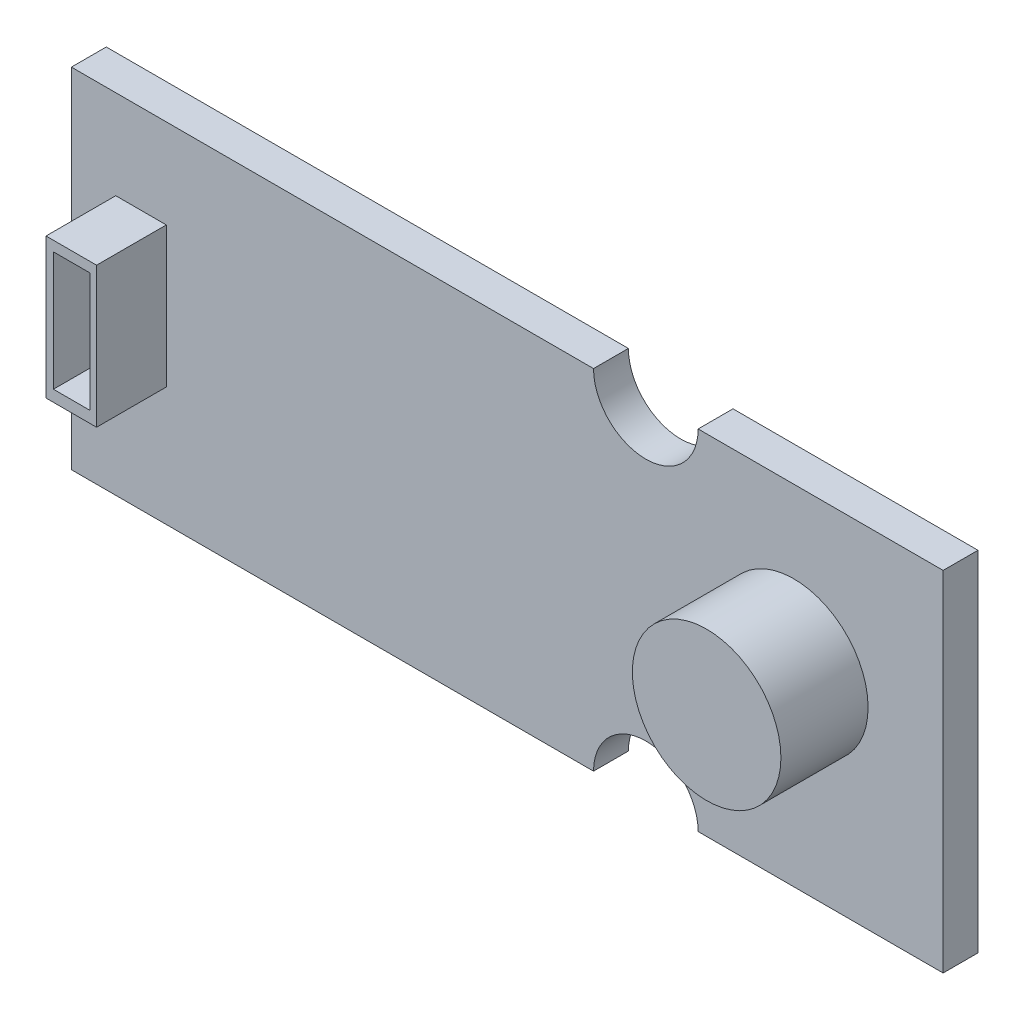
from build123d import *

# Parameters (mm, degrees)
ESQUISSE1_W             = 50
ESQUISSE1_H             = 20
BOSS_EXTRU_1_DEPTH      = 2
ESQUISSE2_R             = 4.260694663
BOSS_EXTRU_2_DEPTH      = 5
ESQUISSE3_R             = 3
ENL_V_MAT_EXTRU_1_DEPTH = 8
ESQUISSE4_W             = 2.90032215
ESQUISSE4_H             = 8.050990352
BOSS_EXTRU_3_DEPTH      = 4
ESQUISSE5_W             = 2.093863404
ESQUISSE5_H             = 6.825994699
ENL_V_MAT_EXTRU_2_DEPTH = 3


with BuildPart() as part:
    # Esquisse1 → Boss.-Extru.1 (new body)
    with BuildSketch(Plane.XY):
        with Locations((3.888470464, 6.071428571)):
            Rectangle(ESQUISSE1_W, ESQUISSE1_H)
    extrude(amount=BOSS_EXTRU_1_DEPTH)

    # Esquisse2 → Boss.-Extru.2 (add)
    with BuildSketch(Plane.XY.offset(2)):
        with Locations((20.32390926, 7.113111312)):
            Circle(ESQUISSE2_R)
    extrude(amount=BOSS_EXTRU_2_DEPTH)

    # Esquisse3 → Enlèv. mat.-Extru.1 (cut)
    with BuildSketch(Plane.XY.offset(2)):
        with Locations((11.836123966, 16.071428571)):
            Circle(ESQUISSE3_R)
        with Locations((11.836123966, -3.928571429)):
            Circle(ESQUISSE3_R)
    extrude(amount=-ENL_V_MAT_EXTRU_1_DEPTH, mode=Mode.SUBTRACT)

    # Esquisse4 → Boss.-Extru.3 (add)
    with BuildSketch(Plane.XY.offset(2)):
        with Locations((-17.118363615, 6.928845047)):
            Rectangle(ESQUISSE4_W, ESQUISSE4_H)
    extrude(amount=BOSS_EXTRU_3_DEPTH)

    # Esquisse5 → Enlèv. mat.-Extru.2 (cut)
    with BuildSketch(Plane.XY.offset(6)):
        with Locations((-17.095752138, 6.967080934)):
            Rectangle(ESQUISSE5_W, ESQUISSE5_H)
    extrude(amount=-ENL_V_MAT_EXTRU_2_DEPTH, mode=Mode.SUBTRACT)


solid = part.part
